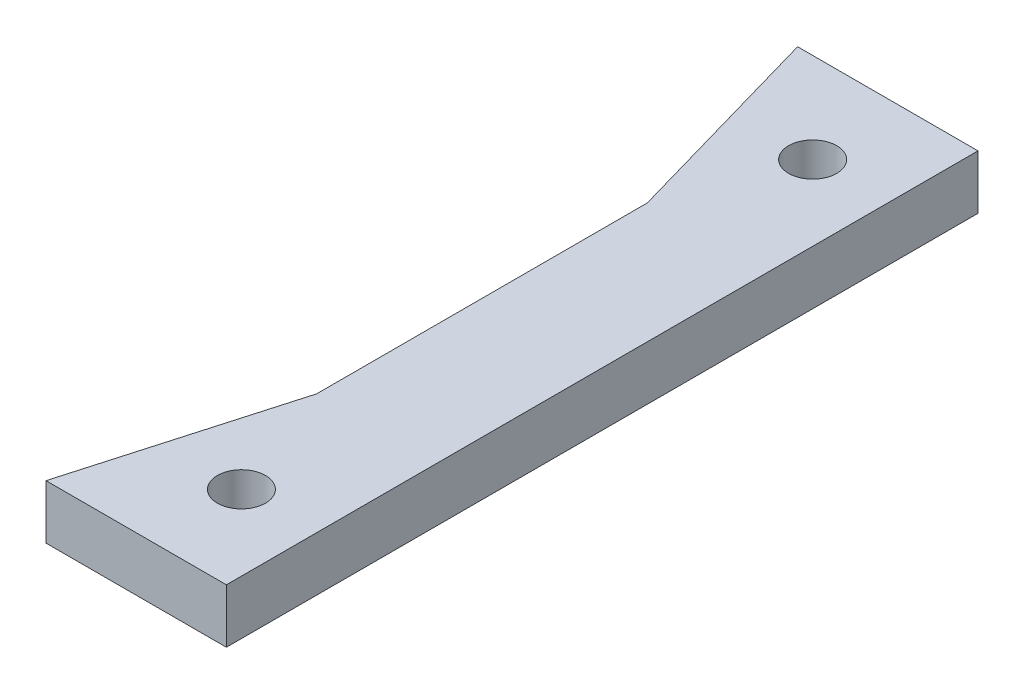
from build123d import *

# Parameters (mm, degrees)
SKETCH1_R           = 4
BOSS_EXTRUDE1_DEPTH = 9


with BuildPart() as part:
    # Sketch1 → Boss-Extrude1 (new body)
    with BuildSketch(Plane(origin=(0, 0, 0), x_dir=(1, 0, 0), z_dir=(0, 1, 0))):
        Polygon((0, 62.5), (0, -62.5), (-30, -62.5), (-20, -27.5), (-20, 27.5), (-30, 62.5), align=None)
        with Locations(Location((-12.5, 47.5, 0), (0, 0, 270))):
            Circle(SKETCH1_R, mode=Mode.SUBTRACT)
        with Locations(Location((-12.5, -47.5, 0), (0, 0, 270))):
            Circle(SKETCH1_R, mode=Mode.SUBTRACT)
    extrude(amount=BOSS_EXTRUDE1_DEPTH)


solid = part.part
